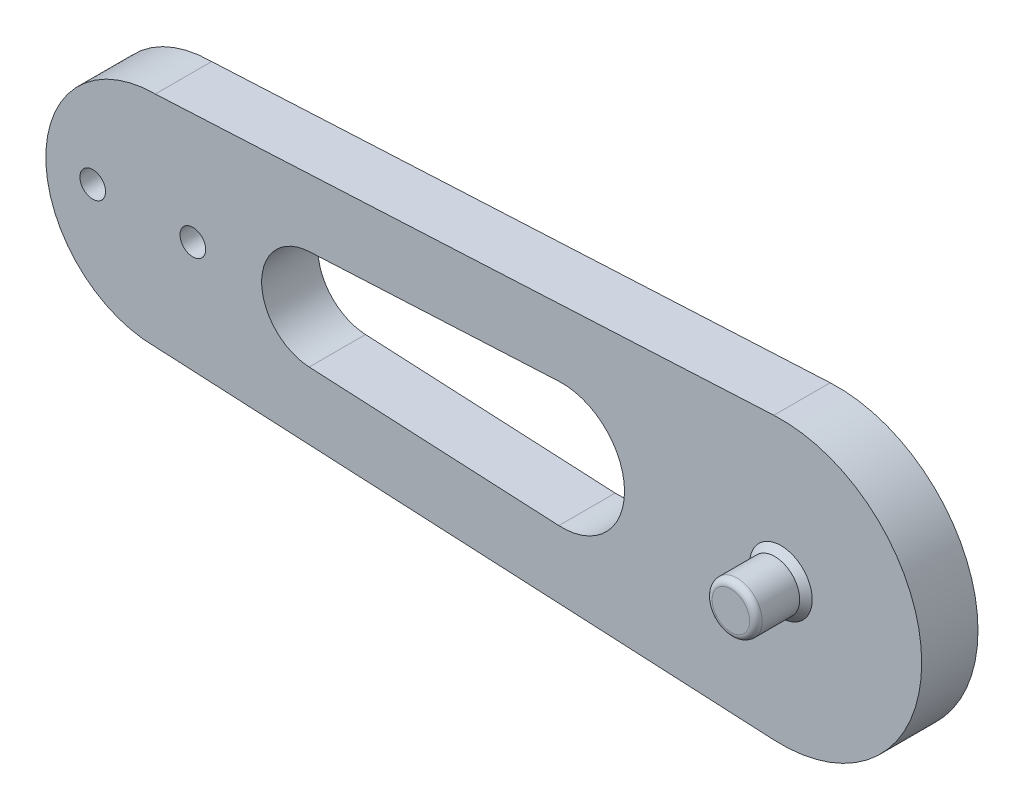
from build123d import *

# Parameters (mm, degrees)
BOSS_EXTRUDE1_DEPTH = 9
BOSS_EXTRUDE2_START = 9
SKETCH3_R           = 4
BOSS_EXTRUDE2_DEPTH = 8
FILLET1_R           = 1
CHAMFER2_SIZE       = 1
CUT_EXTRUDE1_DEPTH  = 6
FILLET3_R           = 1
SKETCH6_R           = 2.05
CUT_EXTRUDE2_DEPTH  = 10


with BuildPart() as part:
    # Sketch2 → Boss-Extrude1 (new body)
    with BuildSketch(Plane(origin=(0, 0, 0), x_dir=(0, 1, 0), z_dir=(0, 0, 1))):
        with BuildLine():
            Line((22.471608109, 1.129968581), (17.5, 100))
            ThreePointArc((17.5, 100), (0, 117.5), (-17.5, 100))
            Line((-17.5, 100), (-22.471608109, 1.129968581))
            ThreePointArc((-22.471608109, 1.129968581), (0, -22.5), (22.471608109, 1.129968581))
        make_face()
    extrude(amount=BOSS_EXTRUDE1_DEPTH)

    # Sketch3 → Boss-Extrude2 (add)
    with BuildSketch(Plane(origin=(0, 0, 0), x_dir=(0, 1, 0), z_dir=(0, 0, 1)).offset(BOSS_EXTRUDE2_START)):
        with Locations(Location((0, 0, 0), (0, 0, 270))):
            Circle(SKETCH3_R)
    extrude(amount=BOSS_EXTRUDE2_DEPTH)

    # Fillet1
    fillet1_edges = [part.edges().sort_by_distance(p)[0] for p in [
        (-4, 0, 17),
    ]]
    fillet(fillet1_edges, radius=FILLET1_R)

    # Chamfer2
    chamfer2_edges = [part.edges().sort_by_distance(p)[0] for p in [
        (-4, 0, 9),
    ]]
    chamfer(chamfer2_edges, length=CHAMFER2_SIZE)

    # Sketch5 → Cut-Extrude1 (cut)
    with BuildSketch(Plane(origin=(0, 0, 0), x_dir=(0, 1, 0), z_dir=(0, 0, 1))):
        with BuildLine():
            Line((-2.677123133, -18.850730282), (-4.65, -3.791767398))
            ThreePointArc((-4.65, -3.791767398), (-6, 0), (-4.65, 3.791767398))
            Line((-4.65, 3.791767398), (-2.677123133, 18.850730282))
            ThreePointArc((-2.677123133, 18.850730282), (0, 21.2), (2.677123133, 18.850730282))
            Line((2.677123133, 18.850730282), (4.65, 3.791767398))
            ThreePointArc((4.65, 3.791767398), (6, 0), (4.65, -3.791767398))
            Line((4.65, -3.791767398), (2.677123133, -18.850730282))
            ThreePointArc((2.677123133, -18.850730282), (0, -21.2), (-2.677123133, -18.850730282))
        make_face()
    extrude(amount=CUT_EXTRUDE1_DEPTH, mode=Mode.SUBTRACT)

    # Fillet3
    fillet3_edges = [part.edges().sort_by_distance(p)[0] for p in [
        (-21.2, 0, 0),
        (0, -6, 0),
        (21.2, 0, 0),
        (0, 6, 0),
        (-11.32124884, 3.663561567, 0),
        (11.32124884, 3.663561567, 0),
        (11.32124884, -3.663561567, 0),
        (-11.32124884, -3.663561567, 0),
    ]]
    fillet(fillet3_edges, radius=FILLET3_R)

    # Sketch6 → Cut-Extrude2 (cut)
    with BuildSketch(Plane(origin=(0, 0, 0), x_dir=(0, 1, 0), z_dir=(0, 0, 1))):
        with Locations(Location((0, 110, 0), (0, 0, 270))):
            Circle(SKETCH6_R)
        with Locations(Location((0, 94, 0), (0, 0, 270))):
            Circle(SKETCH6_R)
        with BuildLine():
            Line((-7.989993742, 75.4), (-9.987492178, 35.5))
            ThreePointArc((-9.987492178, 35.5), (0, 25), (9.987492178, 35.5))
            Line((9.987492178, 35.5), (7.989993742, 75.4))
            ThreePointArc((7.989993742, 75.4), (0, 83), (-7.989993742, 75.4))
        make_face()
    extrude(amount=CUT_EXTRUDE2_DEPTH, mode=Mode.SUBTRACT)


solid = part.part
